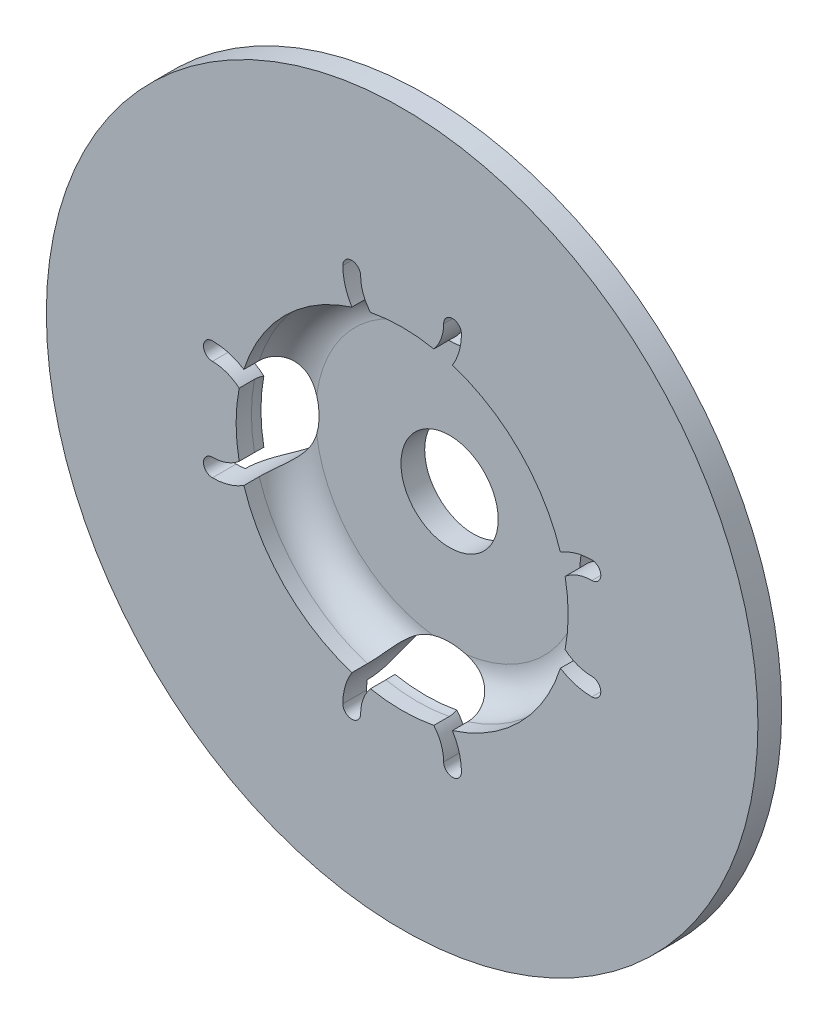
from build123d import *

# Parameters (mm, degrees)
CUT_EXTRUDE1_REACH = 35.675
SKETCH2_R          = 2.5
CUT_EXTRUDE2_DEPTH = 10
SKETCH4_R          = 2.05
CUT_EXTRUDE3_DEPTH = 10


with BuildPart() as part:
    # Sketch1 → Revolve1 (revolve)
    with BuildSketch(Plane(origin=(0, 0, 0), x_dir=(1, 0, 0), z_dir=(0, 1, 0))):
        with BuildLine():
            Line((0, 0), (0, 1))
            Line((0, 1), (7, 1))
            ThreePointArc((7, 1), (7.585786, 2.414214), (9, 3))
            Line((9, 3), (15, 3))
            Line((15, 3), (15, 2))
            Line((15, 2), (9.353553, 2))
            ThreePointArc((9.353553, 2), (8.396447, 1.603553), (8, 0.646447))
            Line((8, 0.646447), (8, 0))
            Line((8, 0), (0, 0))
        make_face()
    revolve(axis=Axis((15, 0, -3), (0, 0, 1)))

    # Cut-Extrude1: up to this face of the body (flat: up to its plane)
    cut_extrude1_end = Plane(part.part.faces().sort_by_distance((29.575736, 0, -1))[0])
    # Sketch2 → Cut-Extrude1 (cut, up to the picked face)
    with BuildSketch(Plane(origin=(0, 0, -3), x_dir=(-1, 0, 0), z_dir=(0, 0, -1)), mode=Mode.PRIVATE) as cut_extrude1_sk1:
        with Locations((-15, 8)):
            Circle(SKETCH2_R)
    cut_extrude1_tool1 = split(extrude(cut_extrude1_sk1.sketch, amount=-CUT_EXTRUDE1_REACH, mode=Mode.PRIVATE), bisect_by=cut_extrude1_end, keep=Keep.BOTH, mode=Mode.PRIVATE)
    # Sketch2 → Cut-Extrude1 (cut, up to the picked face)
    with BuildSketch(Plane(origin=(0, 0, -3), x_dir=(-1, 0, 0), z_dir=(0, 0, -1)), mode=Mode.PRIVATE) as cut_extrude1_sk2:
        with Locations((-7, 0)):
            Circle(SKETCH2_R)
    cut_extrude1_tool2 = split(extrude(cut_extrude1_sk2.sketch, amount=-CUT_EXTRUDE1_REACH, mode=Mode.PRIVATE), bisect_by=cut_extrude1_end, keep=Keep.BOTH, mode=Mode.PRIVATE)
    # Sketch2 → Cut-Extrude1 (cut, up to the picked face)
    with BuildSketch(Plane(origin=(0, 0, -3), x_dir=(-1, 0, 0), z_dir=(0, 0, -1)), mode=Mode.PRIVATE) as cut_extrude1_sk3:
        with Locations((-15, -8)):
            Circle(SKETCH2_R)
    cut_extrude1_tool3 = split(extrude(cut_extrude1_sk3.sketch, amount=-CUT_EXTRUDE1_REACH, mode=Mode.PRIVATE), bisect_by=cut_extrude1_end, keep=Keep.BOTH, mode=Mode.PRIVATE)
    # Sketch2 → Cut-Extrude1 (cut, up to the picked face)
    with BuildSketch(Plane(origin=(0, 0, -3), x_dir=(-1, 0, 0), z_dir=(0, 0, -1)), mode=Mode.PRIVATE) as cut_extrude1_sk4:
        with Locations((-23, 0)):
            Circle(SKETCH2_R)
    cut_extrude1_tool4 = split(extrude(cut_extrude1_sk4.sketch, amount=-CUT_EXTRUDE1_REACH, mode=Mode.PRIVATE), bisect_by=cut_extrude1_end, keep=Keep.BOTH, mode=Mode.PRIVATE)
    add(cut_extrude1_tool1.solids().sort_by(Axis((15, 8, -3), (0, 0, 1)))[0], mode=Mode.SUBTRACT)
    add(cut_extrude1_tool2.solids().sort_by(Axis((7, 0, -3), (0, 0, 1)))[0], mode=Mode.SUBTRACT)
    add(cut_extrude1_tool3.solids().sort_by(Axis((15, -8, -3), (0, 0, 1)))[0], mode=Mode.SUBTRACT)
    add(cut_extrude1_tool4.solids().sort_by(Axis((23, 0, -3), (0, 0, 1)))[0], mode=Mode.SUBTRACT)

    # Sketch3 → Cut-Extrude2 (cut)
    with BuildSketch(Plane(origin=(0, 0, -1), x_dir=(-1, 0, 0), z_dir=(0, 0, -1))):
        with BuildLine():
            ThreePointArc((-12.5, -8), (-15, -5.5), (-17.5, -8))
            ThreePointArc((-17.5, -8), (-17.125, -8.375), (-16.75, -8))
            ThreePointArc((-16.75, -8), (-15, -6.25), (-13.25, -8))
            ThreePointArc((-13.25, -8), (-12.875, -8.375), (-12.5, -8))
        make_face()
        with BuildLine():
            ThreePointArc((-23, -1.75), (-21.25, 0), (-23, 1.75))
            ThreePointArc((-23, 1.75), (-23.375, 2.125), (-23, 2.5))
            ThreePointArc((-23, 2.5), (-20.5, 0), (-23, -2.5))
            ThreePointArc((-23, -2.5), (-23.375, -2.125), (-23, -1.75))
        make_face()
        with BuildLine():
            ThreePointArc((-16.75, 8), (-15, 6.25), (-13.25, 8))
            ThreePointArc((-13.25, 8), (-12.875, 8.375), (-12.5, 8))
            ThreePointArc((-12.5, 8), (-15, 5.5), (-17.5, 8))
            ThreePointArc((-17.5, 8), (-17.125, 8.375), (-16.75, 8))
        make_face()
        with BuildLine():
            ThreePointArc((-7, 1.75), (-8.75, 0), (-7, -1.75))
            ThreePointArc((-7, -1.75), (-6.625, -2.125), (-7, -2.5))
            ThreePointArc((-7, -2.5), (-9.5, 0), (-7, 2.5))
            ThreePointArc((-7, 2.5), (-6.625, 2.125), (-7, 1.75))
        make_face()
    extrude(amount=-CUT_EXTRUDE2_DEPTH, mode=Mode.SUBTRACT)

    # Sketch4 → Cut-Extrude3 (cut)
    with BuildSketch(Plane(origin=(0, 0, -3), x_dir=(-1, 0, 0), z_dir=(0, 0, -1))):
        with Locations((-15, 0)):
            Circle(SKETCH4_R)
    extrude(amount=-CUT_EXTRUDE3_DEPTH, mode=Mode.SUBTRACT)


solid = part.part
